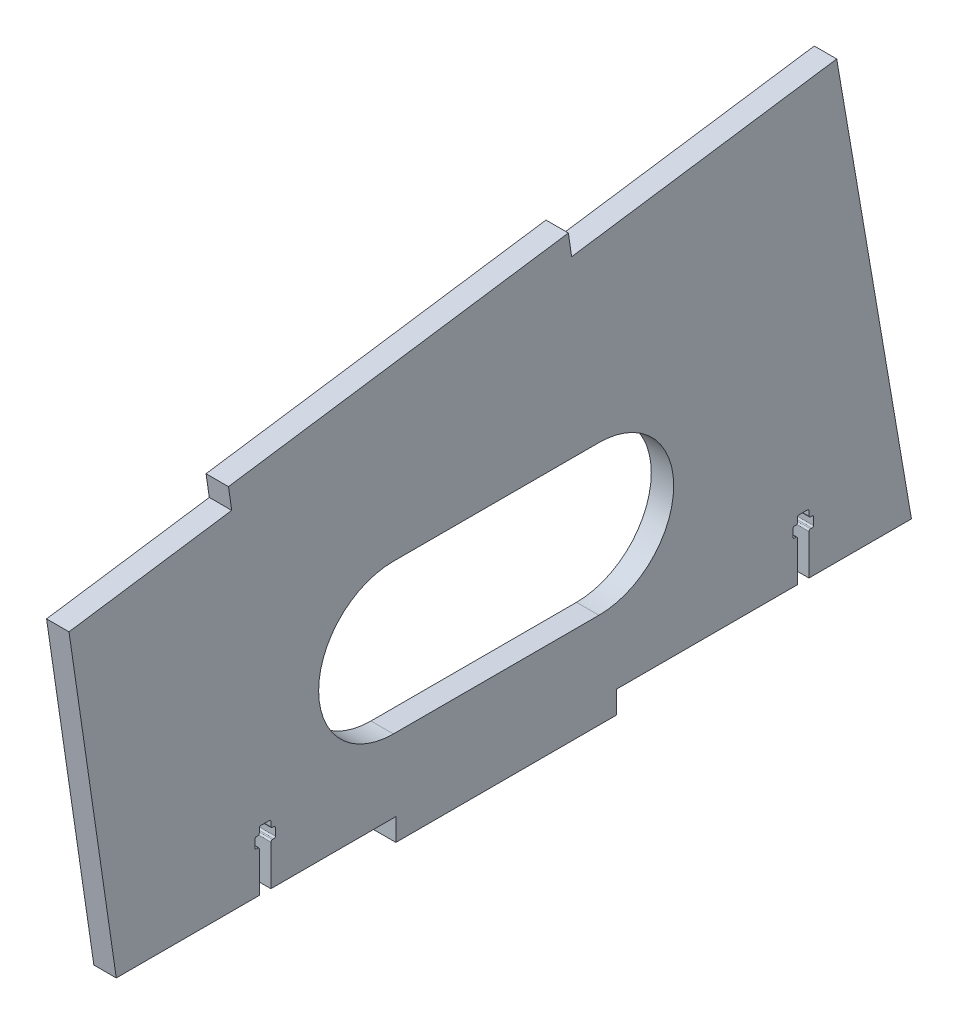
from build123d import *

# Parameters (mm, degrees)
BOSS_EXTRUDE1_DEPTH = 6
CUT_EXTRUDE1_DEPTH  = 6
CUT_EXTRUDE2_DEPTH  = 6
SKETCH5_W           = 3.1
SKETCH5_H           = 16
CUT_EXTRUDE3_DEPTH  = 257.585419281
SKETCH6_W           = 5.5
SKETCH6_H           = 2.8
CUT_EXTRUDE4_DEPTH  = 257.585419281
FILLET1_R           = 0.4
CUT_EXTRUDE5_DEPTH  = 257.585419281


with BuildPart() as part:
    # Sketch1 → Boss-Extrude1 (new body)
    with BuildSketch(Plane(origin=(0, 0, 0), x_dir=(0, 0, -1), z_dir=(1, 0, 0))):
        Polygon((-8.423886954, 100.420733136), (5.846423254, 2.80742232), (224.813620111, 2.80742232), (203.793040966, 125.38142721), (199.85477244, 130.869460409), align=None)
    extrude(amount=BOSS_EXTRUDE1_DEPTH)

    # Sketch2 → Cut-Extrude1 (cut)
    with BuildSketch(Plane(origin=(6, 0, 0), x_dir=(0, 0, -1), z_dir=(1, 0, 0))):
        Polygon((5.846423254, 2.80742232), (85.846423254, 2.80742232), (85.846423254, 8.80742232), (4.969269713, 8.80742232), align=None)
        Polygon((144.813620111, 2.80742232), (144.813620111, 8.80742232), (223.78466234, 8.80742232), (224.813620111, 2.80742232), align=None)
        Polygon((41.050223347, 107.653464977), (41.918151168, 101.716571741), (-7.555959133, 94.4838399), (-8.423886954, 100.420733136), align=None)
        Polygon((131.999265462, 120.949510704), (132.867193283, 115.012617467), (203.793040966, 125.38142721), (199.85477244, 130.869460409), align=None)
    extrude(amount=-CUT_EXTRUDE1_DEPTH, mode=Mode.SUBTRACT)

    # Sketch4 → Cut-Extrude2 (cut)
    with BuildSketch(Plane(origin=(6, 0, 0), x_dir=(0, 0, -1), z_dir=(1, 0, 0))):
        Polygon((-7.555959133, 94.4838399), (-1.619065897, 95.351767721), (11.033047276, 8.80742232), (4.969269713, 8.80742232), align=None)
    extrude(amount=-CUT_EXTRUDE2_DEPTH, mode=Mode.SUBTRACT)

    # Sketch5 → Cut-Extrude3 (cut, through all)
    with BuildSketch(Plane(origin=(6, 0, 0), x_dir=(0, 0, -1), z_dir=(1, 0, 0))):
        with Locations((50.846423254, 16.80742232)):
            Rectangle(SKETCH5_W, SKETCH5_H)
        with Locations((194.813620111, 16.80742232)):
            Rectangle(SKETCH5_W, SKETCH5_H)
    extrude(amount=-CUT_EXTRUDE3_DEPTH, mode=Mode.SUBTRACT)

    # Sketch6 → Cut-Extrude4 (cut, through all)
    with BuildSketch(Plane(origin=(6, 0, 0), x_dir=(0, 0, -1), z_dir=(1, 0, 0))):
        with Locations((50.846423254, 21.40742232)):
            Rectangle(SKETCH6_W, SKETCH6_H)
        with Locations((194.813620111, 21.40742232)):
            Rectangle(SKETCH6_W, SKETCH6_H)
    extrude(amount=-CUT_EXTRUDE4_DEPTH, mode=Mode.SUBTRACT)

    # Fillet1
    fillet1_edges = [part.edges().sort_by_distance(p)[0] for p in [
        (3, 24.80742232, -193.263620111),
        (3, 24.80742232, -196.363620111),
        (3, 20.00742232, -52.396423254),
        (3, 22.80742232, -52.396423254),
        (3, 20.00742232, -196.363620111),
        (3, 22.80742232, -196.363620111),
        (3, 22.80742232, -49.296423254),
        (3, 22.80742232, -48.096423254),
        (3, 20.00742232, -49.296423254),
        (3, 20.00742232, -53.596423254),
        (3, 20.00742232, -48.096423254),
        (3, 22.80742232, -53.596423254),
        (3, 22.80742232, -193.263620111),
        (3, 22.80742232, -192.063620111),
        (3, 20.00742232, -193.263620111),
        (3, 20.00742232, -197.563620111),
        (3, 20.00742232, -192.063620111),
        (3, 22.80742232, -197.563620111),
        (3, 24.80742232, -49.296423254),
        (3, 24.80742232, -52.396423254),
    ]]
    fillet(fillet1_edges, radius=FILLET1_R)

    # Sketch7 → Cut-Extrude5 (cut, through all)
    with BuildSketch(Plane(origin=(6, 0, 0), x_dir=(0, 0, -1), z_dir=(1, 0, 0))):
        with BuildLine():
            Line((85.173180011, 68.290188576), (140.173180011, 68.290188576))
            ThreePointArc((140.173180011, 68.290188576), (160.173180011, 48.290188576), (140.173180011, 28.290188576))
            Line((140.173180011, 28.290188576), (85.173180011, 28.290188576))
            ThreePointArc((85.173180011, 28.290188576), (65.173180011, 48.290188576), (85.173180011, 68.290188576))
        make_face()
    extrude(amount=-CUT_EXTRUDE5_DEPTH, mode=Mode.SUBTRACT)


solid = part.part
